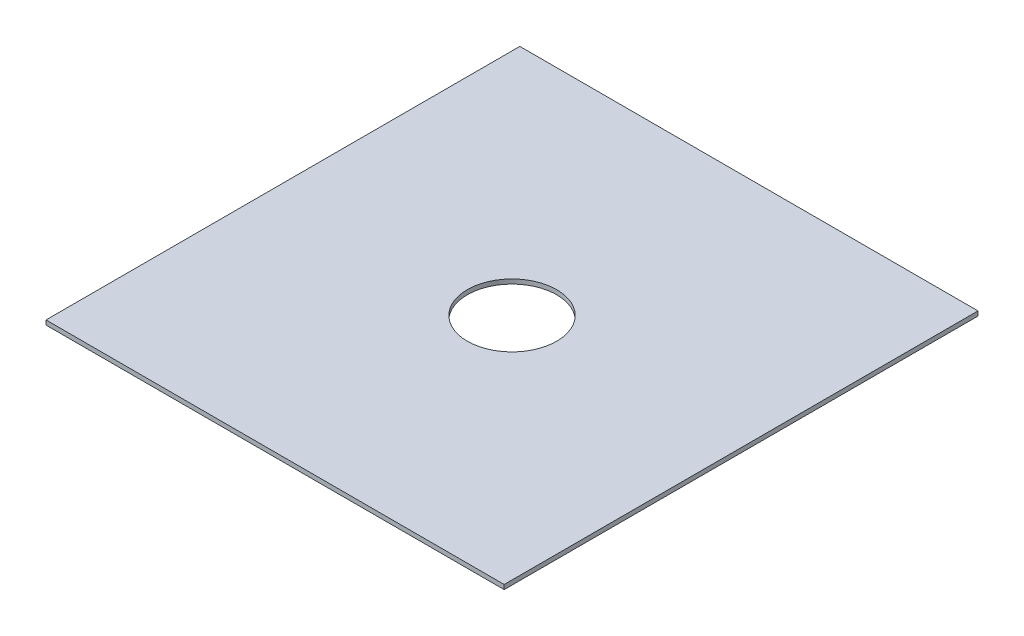
from build123d import *

# Parameters (mm, degrees)
SKETCH1_W           = 325.4375
SKETCH1_H           = 336.55
BOSS_EXTRUDE1_DEPTH = 3.175
SKETCH2_R           = 31.75
CUT_EXTRUDE1_DEPTH  = 235.102430256


with BuildPart() as part:
    # Sketch1 → Boss-Extrude1 (new body)
    with BuildSketch(Plane(origin=(0, 0, 0), x_dir=(1, 0, 0), z_dir=(0, 1, 0))):
        Rectangle(SKETCH1_W, SKETCH1_H)
    extrude(amount=BOSS_EXTRUDE1_DEPTH)

    # Sketch2 → Cut-Extrude1 (cut, through all)
    with BuildSketch(Plane(origin=(0, 3.175, 0), x_dir=(1, 0, 0), z_dir=(0, 1, 0))):
        with Locations(Location((0, 0, 0), (0, 0, 270))):
            Circle(SKETCH2_R)
    extrude(amount=-CUT_EXTRUDE1_DEPTH, mode=Mode.SUBTRACT)


solid = part.part
